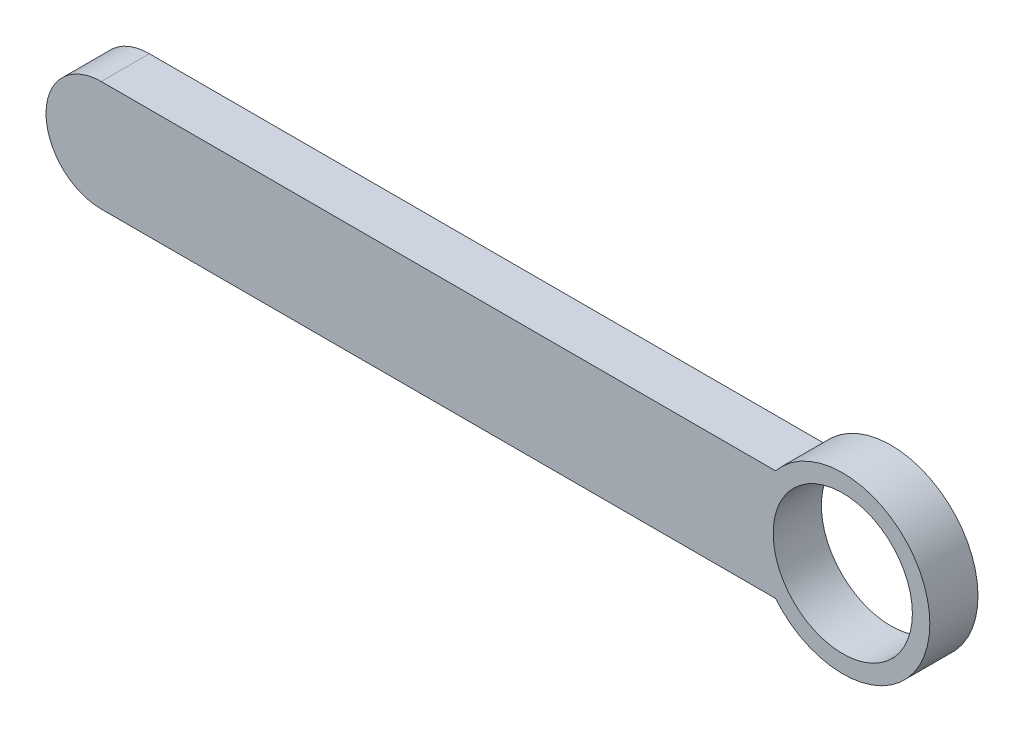
from build123d import *

# Parameters (mm, degrees)
SKETCH1_R           = 4.0005
BOSS_EXTRUDE1_DEPTH = 2.7686


with BuildPart() as part:
    # Sketch1 → Boss-Extrude1 (new body)
    with BuildSketch(Plane.XY):
        with BuildLine():
            Line((-3.867478434, 3.175), (-42.6212, 3.175))
            ThreePointArc((-42.6212, 3.175), (-45.7962, 0), (-42.6212, -3.175))
            Line((-42.6212, -3.175), (-3.867478434, -3.175))
            ThreePointArc((-3.867478434, -3.175), (5.0038, 0), (-3.867478434, 3.175))
        make_face()
        Circle(SKETCH1_R, mode=Mode.SUBTRACT)
    extrude(amount=BOSS_EXTRUDE1_DEPTH)


solid = part.part
